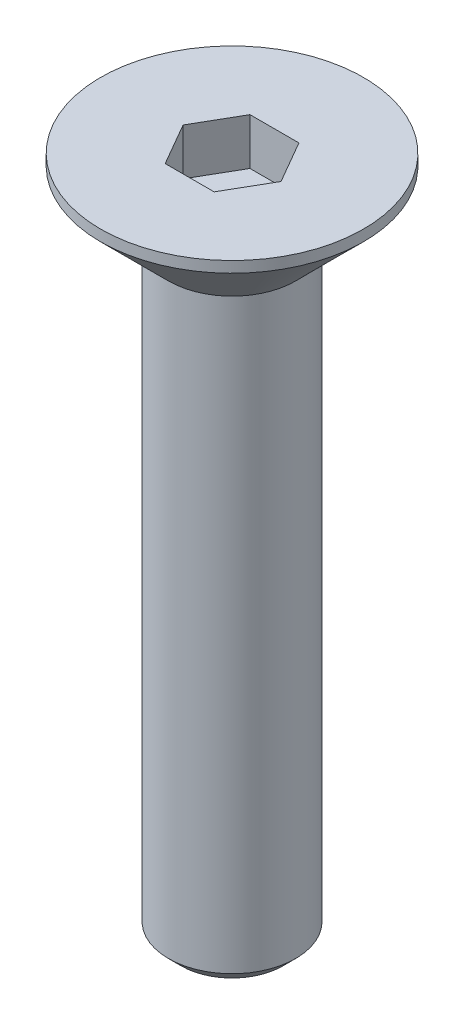
from build123d import *

# Parameters (mm, degrees)
ESQUISSE_TETE_R         = 3.36
EXTRUSION_TETE_DEPTH    = 1.86
ENL_V_MAT_EXTRU_1_DEPTH = 1.1
ESQUISSE_CORPS_R        = 1.5
EXTRUSION_CORPS_DEPTH   = 14.14
CHANFREIN_SIZE          = 0.3


with BuildPart() as part:
    # Esquisse TETE → Extrusion TETE (new body)
    with BuildSketch(Plane(origin=(0, 0, 0), x_dir=(1, 0, 0), z_dir=(0, 1, 0))):
        with Locations(Location((0, 0, 0), (0, 0, 270))):
            Circle(ESQUISSE_TETE_R)
    extrude(amount=-EXTRUSION_TETE_DEPTH)

    # Esquisse1 → Enlèv. mat.-Extru.1 (cut)
    with BuildSketch(Plane(origin=(0, 0, 0), x_dir=(1, 0, 0), z_dir=(0, 1, 0))):
        Polygon((0.577350269, -1), (1.154700538, 0), (0.577350269, 1), (-0.577350269, 1), (-1.154700538, 0), (-0.577350269, -1), align=None)
    extrude(amount=-ENL_V_MAT_EXTRU_1_DEPTH, mode=Mode.SUBTRACT)

    # Esquisse CORPS → Extrusion CORPS (add)
    with BuildSketch(Plane.XZ.offset(1.86)):
        with Locations(Location((0, 0, 0), (0, 0, 90))):
            Circle(ESQUISSE_CORPS_R)
    extrude(amount=EXTRUSION_CORPS_DEPTH)

    # Esquisse FRAISAGE → Enlèvement de matière-Révolution1 (revolve, cut)
    with BuildSketch(Plane(origin=(0, 0, 0), x_dir=(0, 0, -1), z_dir=(1, 0, 0))):
        Polygon((-1.5, -1.86), (-3.1, -0.26), (-3.1, 0), (-3.36, 0), (-3.36, -1.86), align=None)
    revolve(axis=Axis((0, 0, 0), (0, -1, 0)), mode=Mode.SUBTRACT)

    # Chanfrein
    chanfrein_edges = [part.edges().sort_by_distance(p)[0] for p in [
        (0, -16, -1.5),
    ]]
    chamfer(chanfrein_edges, length=CHANFREIN_SIZE)


solid = part.part
